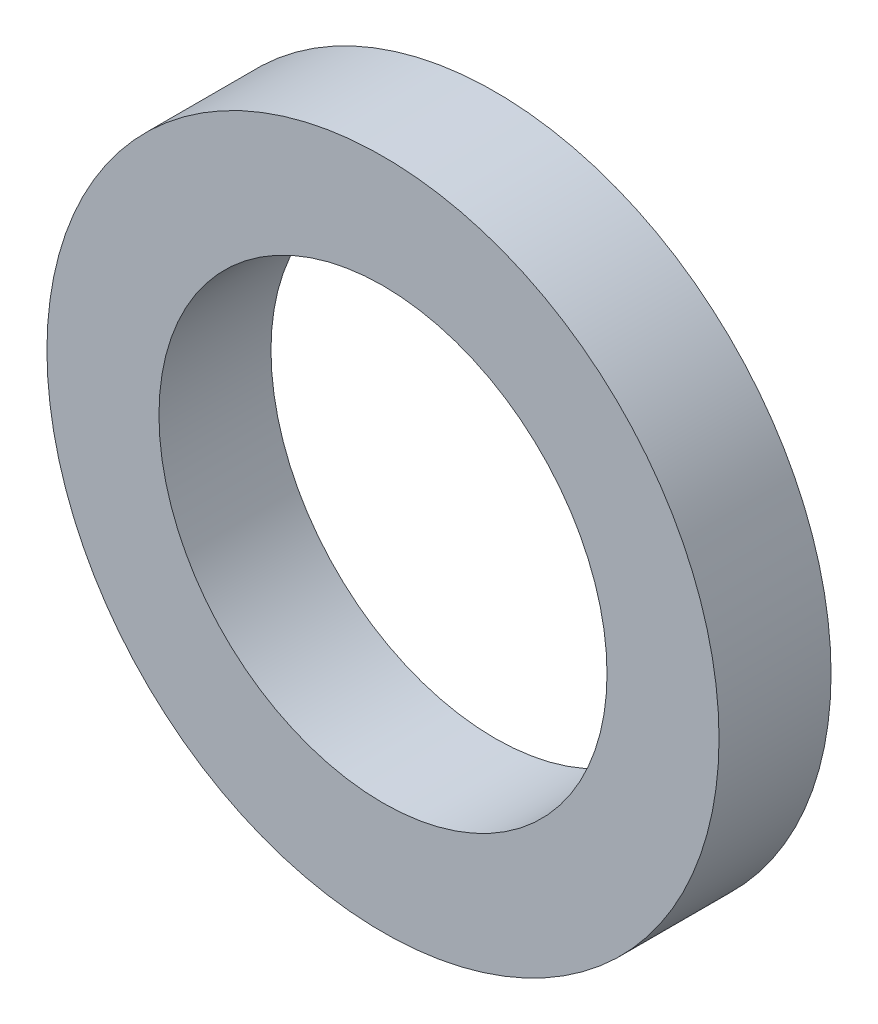
from build123d import *

# Parameters (mm, degrees)
SKETCH_2_R          = 15
EXTRUDE_1_DEPTH     = 5
SKETCH_3_R          = 10
CUT_EXTRUDE_1_DEPTH = 20


with BuildPart() as part:
    # 草图2 → 凸台-拉伸1 (new body)
    with BuildSketch(Plane.XY):
        Circle(SKETCH_2_R)
    extrude(amount=EXTRUDE_1_DEPTH)

    # 草图3 → 切除-拉伸1 (cut)
    with BuildSketch(Plane.XY.offset(5)):
        Circle(SKETCH_3_R)
    extrude(amount=-CUT_EXTRUDE_1_DEPTH, mode=Mode.SUBTRACT)


solid = part.part
